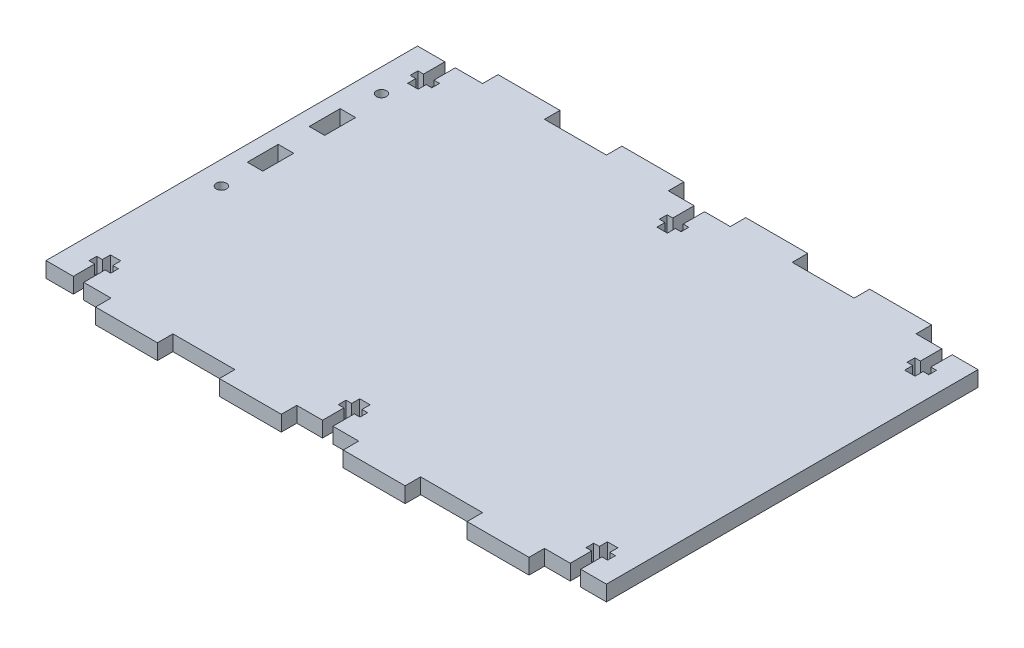
from build123d import *

# Parameters (mm, degrees)
SKETCH1_W           = 229.859874896
SKETCH1_H           = 6.35
BOSS_EXTRUDE1_DEPTH = 152.4
SKETCH2_W           = 25.4
SKETCH2_H           = 6.35
BOSS_EXTRUDE2_DEPTH = 6.35
LPATTERN1_COUNT     = 4
LPATTERN1_PITCH     = 50.8
SKETCH3_W           = 25.4
SKETCH3_H           = 6.35
BOSS_EXTRUDE3_DEPTH = 6.35
LPATTERN2_COUNT     = 4
LPATTERN2_PITCH     = 50.8
CUT_EXTRUDE1_DEPTH  = 6.35
SKETCH5_W           = 6.35
SKETCH5_H           = 12.7
CUT_EXTRUDE2_DEPTH  = 212.329778686
SKETCH6_R           = 2.0955
CUT_EXTRUDE3_DEPTH  = 212.329778686


with BuildPart() as part:
    # Sketch1 → Boss-Extrude1 (new body)
    with BuildSketch(Plane.XY):
        with Locations((-24.419947229, 152.4)):
            Rectangle(SKETCH1_W, SKETCH1_H)
    extrude(amount=BOSS_EXTRUDE1_DEPTH)

    # Sketch2 → Boss-Extrude2 (add)
    with BuildSketch(Plane(origin=(0, 155.575, 0), x_dir=(1, 0, 0), z_dir=(0, 1, 0))):
        with Locations((52.409990219, 3.175)):
            Rectangle(SKETCH2_W, SKETCH2_H)
    boss_extrude2 = extrude(amount=-BOSS_EXTRUDE2_DEPTH)

    # LPattern1: Boss-Extrude2 ×4
    with Locations(*[(-i * LPATTERN1_PITCH, 0, 0) for i in range(1, LPATTERN1_COUNT)]):
        add(boss_extrude2)

    # Sketch3 → Boss-Extrude3 (add)
    with BuildSketch(Plane.XY.offset(152.4)):
        with Locations((52.409990219, 152.4)):
            Rectangle(SKETCH3_W, SKETCH3_H)
    boss_extrude3 = extrude(amount=BOSS_EXTRUDE3_DEPTH)

    # LPattern2: Boss-Extrude3 ×4
    with Locations(*[(-i * LPATTERN2_PITCH, 0, 0) for i in range(1, LPATTERN2_COUNT)]):
        add(boss_extrude3)

    # Sketch4 → Cut-Extrude1 (cut)
    with BuildSketch(Plane(origin=(0, 155.575, 0), x_dir=(1, 0, 0), z_dir=(0, 1, 0))):
        Polygon((-123.886347229, 0), (-128.153547229, 0), (-128.153547229, -8.763), (-130.464947229, -8.763), (-130.464947229, -11.938), (-128.153547229, -11.938), (-128.153547229, -15.24), (-123.886347229, -15.24), (-123.886347229, -11.938), (-121.574947229, -11.938), (-121.574947229, -8.763), (-123.886347229, -8.763), align=None)
        Polygon((-21.656409781, 0), (-25.923609781, 0), (-25.923609781, -8.763), (-28.235009781, -8.763), (-28.235009781, -11.938), (-25.923609781, -11.938), (-25.923609781, -15.24), (-21.656409781, -15.24), (-21.656409781, -11.938), (-19.345009781, -11.938), (-19.345009781, -8.763), (-21.656409781, -8.763), align=None)
        Polygon((79.943590219, 0), (75.676390219, 0), (75.676390219, -8.763), (73.364990219, -8.763), (73.364990219, -11.938), (75.676390219, -11.938), (75.676390219, -15.24), (79.943590219, -15.24), (79.943590219, -11.938), (82.254990219, -11.938), (82.254990219, -8.763), (79.943590219, -8.763), align=None)
        Polygon((-128.153547229, -152.4), (-123.886347229, -152.4), (-123.886347229, -143.637), (-121.574947229, -143.637), (-121.574947229, -140.462), (-123.886347229, -140.462), (-123.886347229, -137.16), (-128.153547229, -137.16), (-128.153547229, -140.462), (-130.464947229, -140.462), (-130.464947229, -143.637), (-128.153547229, -143.637), align=None)
        Polygon((-25.923609781, -152.4), (-21.656409781, -152.4), (-21.656409781, -143.637), (-19.345009781, -143.637), (-19.345009781, -140.462), (-21.656409781, -140.462), (-21.656409781, -137.16), (-25.923609781, -137.16), (-25.923609781, -140.462), (-28.235009781, -140.462), (-28.235009781, -143.637), (-25.923609781, -143.637), align=None)
        Polygon((75.676390219, -152.4), (79.943590219, -152.4), (79.943590219, -143.637), (82.254990219, -143.637), (82.254990219, -140.462), (79.943590219, -140.462), (79.943590219, -137.16), (75.676390219, -137.16), (75.676390219, -140.462), (73.364990219, -140.462), (73.364990219, -143.637), (75.676390219, -143.637), align=None)
    extrude(amount=-CUT_EXTRUDE1_DEPTH, mode=Mode.SUBTRACT)

    # Sketch5 → Cut-Extrude2 (cut, through all)
    with BuildSketch(Plane(origin=(0, 155.575, 0), x_dir=(1, 0, 0), z_dir=(0, 1, 0))):
        with Locations((-129.824884677, -44.45)):
            Rectangle(SKETCH5_W, SKETCH5_H)
        with Locations((-129.824884677, -69.85)):
            Rectangle(SKETCH5_W, SKETCH5_H)
    extrude(amount=-CUT_EXTRUDE2_DEPTH, mode=Mode.SUBTRACT)

    # Sketch6 → Cut-Extrude3 (cut, through all)
    with BuildSketch(Plane(origin=(0, 155.575, 0), x_dir=(1, 0, 0), z_dir=(0, 1, 0))):
        with Locations(Location((-129.824884677, -89.98, 0), (0, 0, 270))):
            Circle(SKETCH6_R)
        with Locations(Location((-129.824884677, -24.32, 0), (0, 0, 270))):
            Circle(SKETCH6_R)
    extrude(amount=-CUT_EXTRUDE3_DEPTH, mode=Mode.SUBTRACT)


solid = part.part
